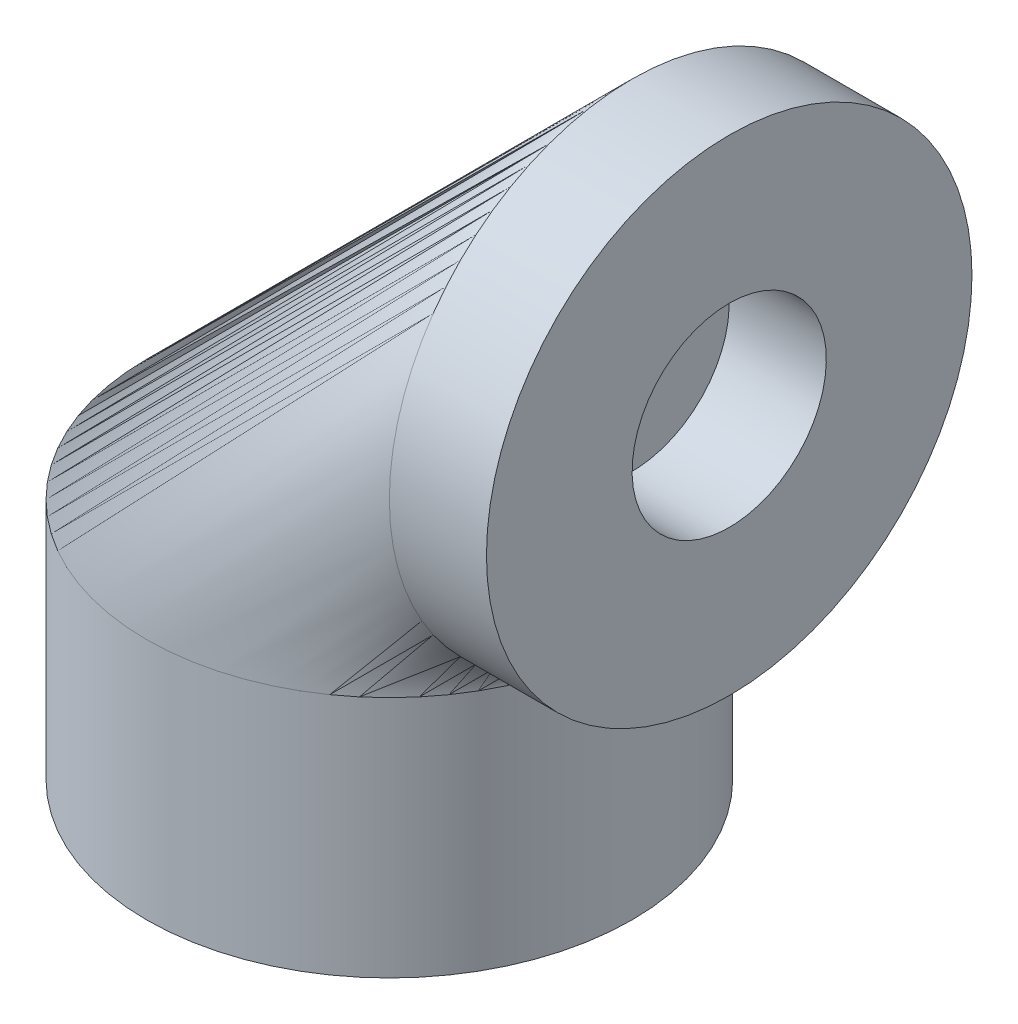
from build123d import *

# Parameters (mm, degrees)
SKETCH1_R           = 50
BOSS_EXTRUDE1_DEPTH = 50
SKETCH2_R           = 50
SKETCH5_R           = 50
BOSS_EXTRUDE2_DEPTH = 20
SKETCH6_R           = 20
CUT_EXTRUDE1_DEPTH  = 20
SKETCH7_R           = 20
BOSS_EXTRUDE3_DEPTH = 20


with BuildPart() as part:
    # Sketch1 → Boss-Extrude1 (new body)
    with BuildSketch(Plane(origin=(0, 0, 0), x_dir=(1, 0, 0), z_dir=(0, 1, 0))):
        with Locations(Location((0, 0, 0), (0, 0, 270))):
            Circle(SKETCH1_R)
    extrude(amount=BOSS_EXTRUDE1_DEPTH)

    # Sweep1: sweep along a path in Sketch3
    with BuildLine(Plane.XY) as sweep1_path:
        ThreePointArc((50, 100), (14.644660941, 85.355339059), (0, 50))
    # Sketch2 → Sweep1 (sweep)
    with BuildSketch(Plane(origin=(0, 50, 0), x_dir=(1, 0, 0), z_dir=(0, 1, 0))):
        Circle(SKETCH2_R)
    sweep(path=sweep1_path.line)

    # Sketch5 → Boss-Extrude2 (add)
    with BuildSketch(Plane(origin=(50, 0, 0), x_dir=(0, 0, -1), z_dir=(1, 0, 0))):
        with Locations(Location((0, 100, 0), (0, 0, 270))):
            Circle(SKETCH5_R)
    extrude(amount=BOSS_EXTRUDE2_DEPTH)

    # Sketch6 → Cut-Extrude1 (cut)
    with BuildSketch(Plane(origin=(70, 0, 0), x_dir=(0, 0, -1), z_dir=(1, 0, 0))):
        with Locations(Location((0, 100, 0), (0, 0, 90))):
            Circle(SKETCH6_R)
    extrude(amount=-CUT_EXTRUDE1_DEPTH, mode=Mode.SUBTRACT)

    # Sketch7 → Boss-Extrude3 (add)
    with BuildSketch(Plane.XZ):
        with Locations(Location((0, 0, 0), (0, 0, 270))):
            Circle(SKETCH7_R)
    extrude(amount=BOSS_EXTRUDE3_DEPTH)


solid = part.part
